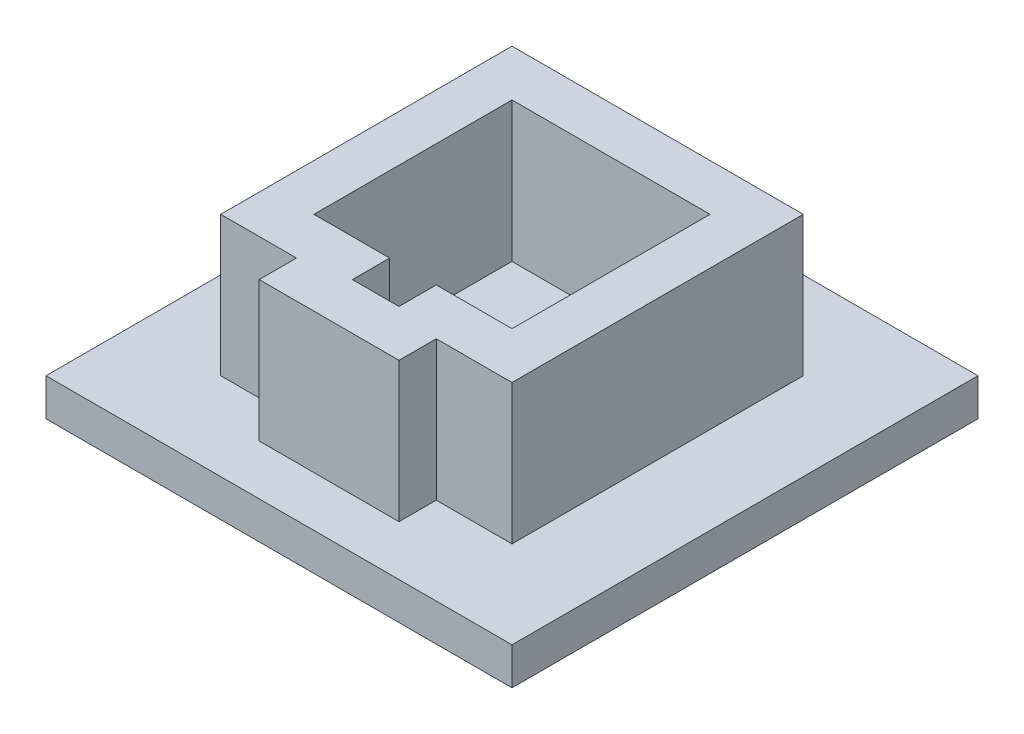
from build123d import *

# Parameters (mm, degrees)
IZIM1_W                     = 100
IZIM1_H                     = 100
Y_KSEKLIK_EKSTR_ZYON1_DEPTH = 8
IZIM2_W                     = 100
IZIM2_H                     = 100
Y_KSEKLIK_EKSTR_ZYON2_DEPTH = 30
IZIM3_W                     = 100
IZIM3_H                     = 100
KES_EKSTR_ZYON1_DEPTH       = 30


with BuildPart() as part:
    # Çizim1 → Yükseklik-Ekstrüzyon1 (new body)
    with BuildSketch(Plane(origin=(0, 0, 0), x_dir=(1, 0, 0), z_dir=(0, 1, 0))):
        with Locations((50, 50)):
            Rectangle(IZIM1_W, IZIM1_H)
    extrude(amount=Y_KSEKLIK_EKSTR_ZYON1_DEPTH)

    # Çizim2 → Yükseklik-Ekstrüzyon2 (add)
    with BuildSketch(Plane(origin=(0, 8, 0), x_dir=(1, 0, 0), z_dir=(0, 1, 0))):
        with Locations((50, 50)):
            Rectangle(IZIM2_W, IZIM2_H)
        Polygon((55, 28.75), (71.25, 28.75), (71.25, 71.25), (28.75, 71.25), (28.75, 28.75), (45, 28.75), (45, 20.75), (55, 20.75), align=None, mode=Mode.SUBTRACT)
    extrude(amount=Y_KSEKLIK_EKSTR_ZYON2_DEPTH)

    # Çizim3 → Kes-Ekstrüzyon1 (cut)
    with BuildSketch(Plane(origin=(0, 38, 0), x_dir=(1, 0, 0), z_dir=(0, 1, 0))):
        with Locations((50, 50)):
            Rectangle(IZIM3_W, IZIM3_H)
        Polygon((18.75, 81.25), (81.25, 81.25), (81.25, 18.75), (65, 18.75), (65, 10.75), (35, 10.75), (35, 18.75), (18.75, 18.75), align=None, mode=Mode.SUBTRACT)
    extrude(amount=-KES_EKSTR_ZYON1_DEPTH, mode=Mode.SUBTRACT)


solid = part.part
